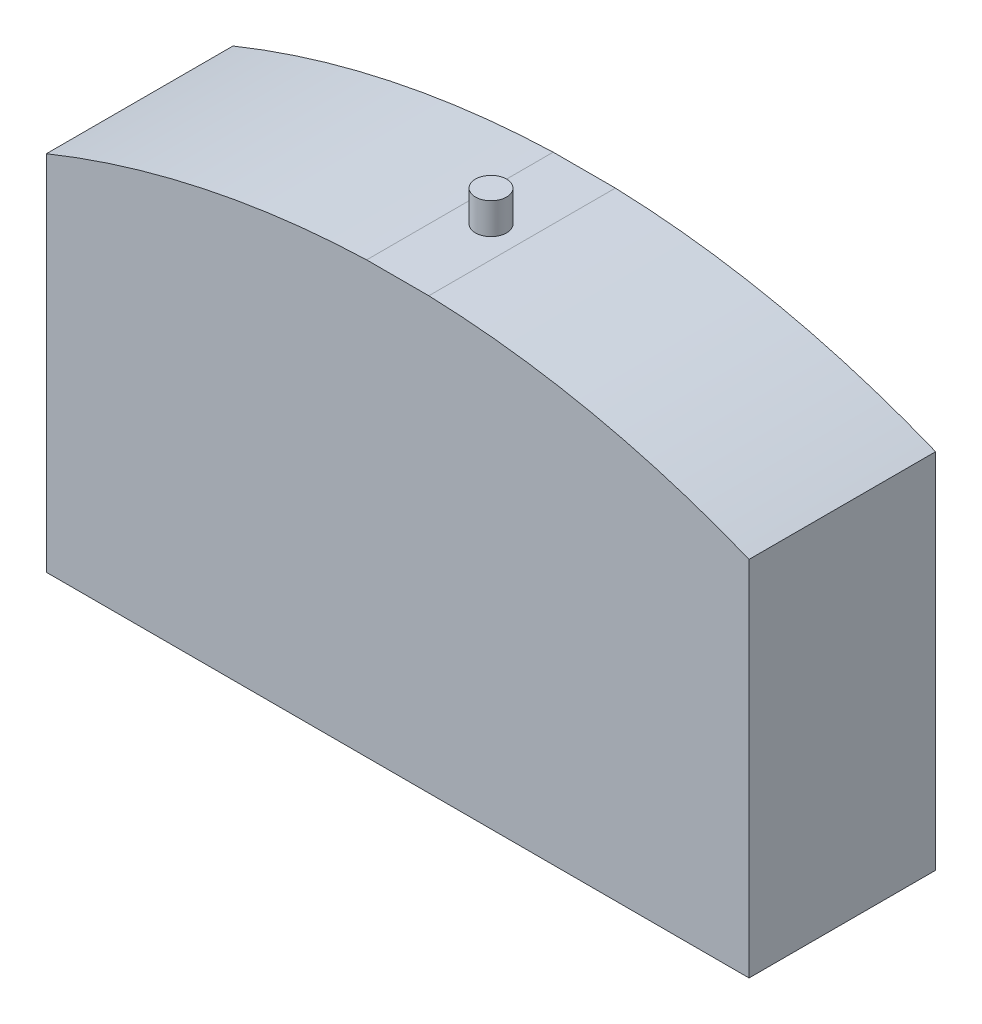
from build123d import *

# Parameters (mm, degrees)
BOSS_EXTRUDE1_DEPTH = 30
CUT_EXTRUDE1_DEPTH  = 27
SKETCH3_R           = 2.5
BOSS_EXTRUDE2_DEPTH = 5


with BuildPart() as part:
    # Sketch1 → Boss-Extrude1 (new body)
    with BuildSketch(Plane.XY):
        with BuildLine():
            Line((-5, 149.916643506), (5, 149.916643506))
            ThreePointArc((5, 149.916643506), (31.23486102, 146.711906324), (56.5, 138.952329955))
            Line((56.5, 138.952329955), (56.5, 80.652329955))
            Line((56.5, 80.652329955), (-56.5, 80.652329955))
            Line((-56.5, 80.652329955), (-56.5, 138.952329955))
            ThreePointArc((-56.5, 138.952329955), (-31.23486102, 146.711906324), (-5, 149.916643506))
        make_face()
    extrude(amount=BOSS_EXTRUDE1_DEPTH)

    # Sketch2 → Cut-Extrude1 (cut)
    with BuildSketch(Plane(origin=(0, 0, 0), x_dir=(-1, 0, 0), z_dir=(0, 0, -1))):
        with BuildLine():
            Line((4.949733431, 146.916643506), (-4.949733431, 146.916643506))
            ThreePointArc((-4.949733431, 146.916643506), (-29.649320321, 143.978879717), (-53.5, 136.91877154))
            Line((-53.5, 136.91877154), (-53.5, 83.652329955))
            Line((-53.5, 83.652329955), (53.5, 83.652329955))
            Line((53.5, 83.652329955), (53.5, 136.91877154))
            ThreePointArc((53.5, 136.91877154), (29.649320321, 143.978879717), (4.949733431, 146.916643506))
        make_face()
    extrude(amount=-CUT_EXTRUDE1_DEPTH, mode=Mode.SUBTRACT)

    # Sketch3 → Boss-Extrude2 (add)
    with BuildSketch(Plane(origin=(0, 149.916643506, 0), x_dir=(1, 0, 0), z_dir=(0, 1, 0))):
        with Locations(Location((0, -15, 0), (0, 0, 270))):
            Circle(SKETCH3_R)
    extrude(amount=BOSS_EXTRUDE2_DEPTH)


solid = part.part
